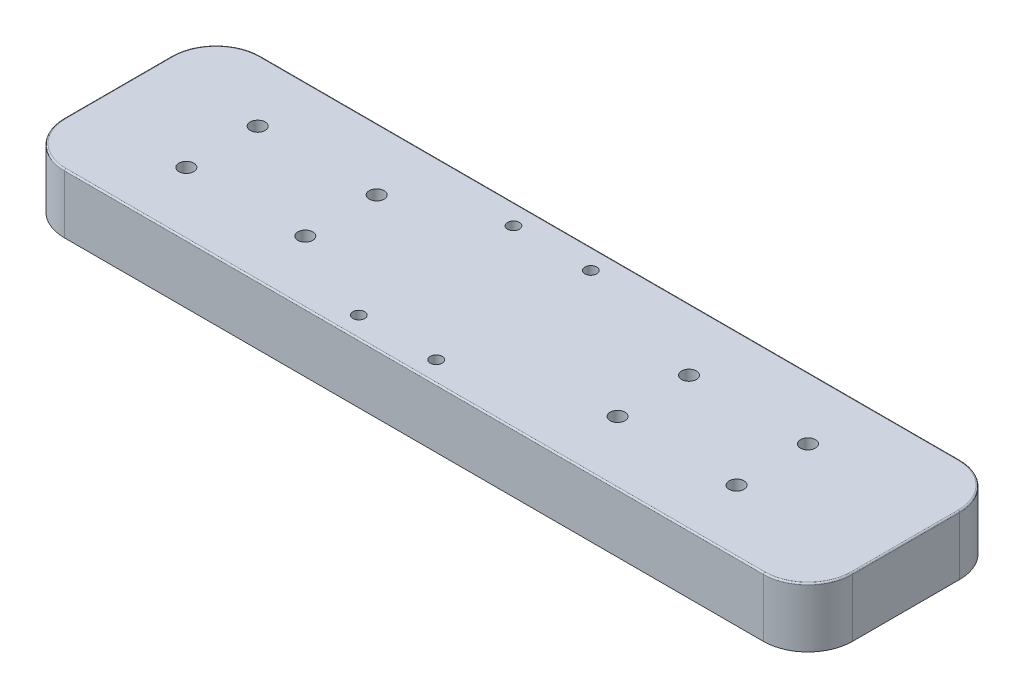
from build123d import *

# Parameters (mm, degrees)
BOSS_EXTRUDE1_DEPTH = 254
CUT_EXTRUDE1_DEPTH  = 381
SKETCH3_R           = 63.5
SKETCH3_R_2         = 50.8
CUT_EXTRUDE2_DEPTH  = 127
FILLET1_R           = 12.7


with BuildPart() as part:
    # Sketch1 → Boss-Extrude1 (new, symmetric)
    with BuildSketch(Plane(origin=(0, 0, 0), x_dir=(1, 0, 0), z_dir=(0, 1, 0))):
        with BuildLine():
            Line((-2984.5, 838.2), (2984.5, 838.2))
            ThreePointArc((2984.5, 838.2), (3253.907683632, 726.607683632), (3365.5, 457.2))
            Line((3365.5, 457.2), (3365.5, -457.2))
            ThreePointArc((3365.5, -457.2), (3253.907683632, -726.607683632), (2984.5, -838.2))
            Line((2984.5, -838.2), (-2984.5, -838.2))
            ThreePointArc((-2984.5, -838.2), (-3253.907683632, -726.607683632), (-3365.5, -457.2))
            Line((-3365.5, -457.2), (-3365.5, 457.2))
            ThreePointArc((-3365.5, 457.2), (-3253.907683632, 726.607683632), (-2984.5, 838.2))
        make_face()
    extrude(amount=BOSS_EXTRUDE1_DEPTH, both=True)

    # Sketch2 → Cut-Extrude1 (cut)
    with BuildSketch(Plane.XZ.offset(254)):
        with BuildLine():
            Line((3238.5, -457.2), (3238.5, 457.2))
            ThreePointArc((3238.5, 457.2), (3164.105122421, 636.805122421), (2984.5, 711.2))
            Line((2984.5, 711.2), (-2984.5, 711.2))
            ThreePointArc((-2984.5, 711.2), (-3164.105122421, 636.805122421), (-3238.5, 457.2))
            Line((-3238.5, 457.2), (-3238.5, -457.2))
            ThreePointArc((-3238.5, -457.2), (-3164.105122421, -636.805122421), (-2984.5, -711.2))
            Line((-2984.5, -711.2), (2984.5, -711.2))
            ThreePointArc((2984.5, -711.2), (3164.105122421, -636.805122421), (3238.5, -457.2))
        make_face()
    extrude(amount=-CUT_EXTRUDE1_DEPTH, mode=Mode.SUBTRACT)

    # Sketch3 → Cut-Extrude2 (cut)
    with BuildSketch(Plane(origin=(0, 254, 0), x_dir=(1, 0, 0), z_dir=(0, 1, 0))):
        with Locations(Location((-2476.5, 304.8, 0), (0, 0, 270))):
            Circle(SKETCH3_R)
        with Locations(Location((-1460.5, 304.8, 0), (0, 0, 270))):
            Circle(SKETCH3_R)
        with Locations(Location((-647.7, 660.4, 0), (0, 0, 270))):
            Circle(SKETCH3_R_2)
        with Locations(Location((12.7, 660.4, 0), (0, 0, 270))):
            Circle(SKETCH3_R_2)
        with Locations(Location((1206.5, 304.8, 0), (0, 0, 270))):
            Circle(SKETCH3_R)
        with Locations(Location((2222.5, 304.8, 0), (0, 0, 270))):
            Circle(SKETCH3_R)
        with Locations(Location((-2476.5, -304.8, 0), (0, 0, 270))):
            Circle(SKETCH3_R)
        with Locations(Location((-1460.5, -304.8, 0), (0, 0, 270))):
            Circle(SKETCH3_R)
        with Locations(Location((-647.7, -660.4, 0), (0, 0, 270))):
            Circle(SKETCH3_R_2)
        with Locations(Location((12.7, -660.4, 0), (0, 0, 270))):
            Circle(SKETCH3_R_2)
        with Locations(Location((1206.5, -304.8, 0), (0, 0, 270))):
            Circle(SKETCH3_R)
        with Locations(Location((2222.5, -304.8, 0), (0, 0, 270))):
            Circle(SKETCH3_R)
    extrude(amount=-CUT_EXTRUDE2_DEPTH, mode=Mode.SUBTRACT)

    # Fillet1
    fillet1_edges = [part.edges().sort_by_distance(p)[0] for p in [
        (3253.907683632, 254, -726.607683632),
        (0, 254, -838.2),
        (-3253.907683632, 254, -726.607683632),
        (-3365.5, 254, 0),
        (-3253.907683632, 254, 726.607683632),
        (3164.105122421, -254, -636.805122421),
        (3238.5, -254, 0),
        (3164.105122421, -254, 636.805122421),
        (0, -254, 711.2),
        (0, 254, 838.2),
        (-3164.105122421, -254, 636.805122421),
        (-3238.5, -254, 0),
        (-3164.105122421, -254, -636.805122421),
        (0, -254, -711.2),
        (3253.907683632, 254, 726.607683632),
        (3365.5, 254, 0),
    ]]
    fillet(fillet1_edges, radius=FILLET1_R)


solid = part.part
